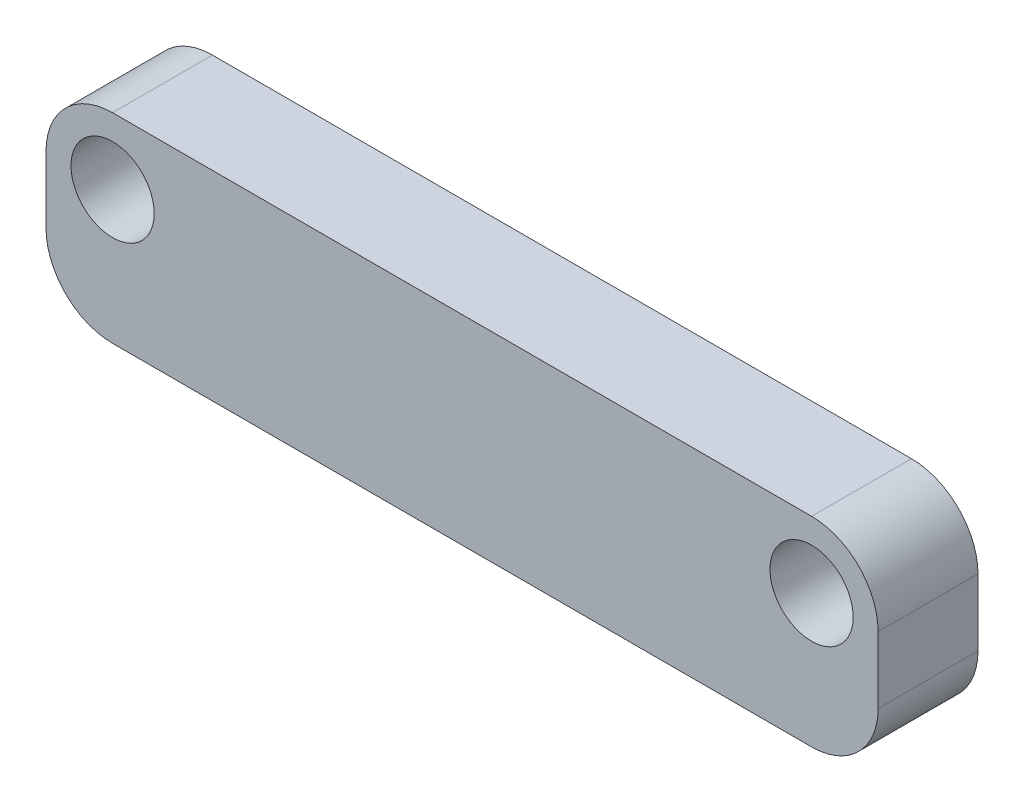
from build123d import *

# Parameters (mm, degrees)
SKETCH1_R           = 2.5
BOSS_EXTRUDE3_DEPTH = 6


with BuildPart() as part:
    # Sketch1 → Boss-Extrude3 (new body)
    with BuildSketch(Plane.XY):
        with BuildLine():
            Line((-21, 6), (21, 6))
            ThreePointArc((21, 6), (23.828427125, 4.828427125), (25, 2))
            Line((25, 2), (25, -2))
            ThreePointArc((25, -2), (23.828427125, -4.828427125), (21, -6))
            Line((21, -6), (-21, -6))
            ThreePointArc((-21, -6), (-23.828427125, -4.828427125), (-25, -2))
            Line((-25, -2), (-25, 2))
            ThreePointArc((-25, 2), (-23.828427125, 4.828427125), (-21, 6))
        make_face()
        with Locations((-21, 2)):
            Circle(SKETCH1_R, mode=Mode.SUBTRACT)
        with Locations((21, 2)):
            Circle(SKETCH1_R, mode=Mode.SUBTRACT)
    extrude(amount=BOSS_EXTRUDE3_DEPTH)


solid = part.part
